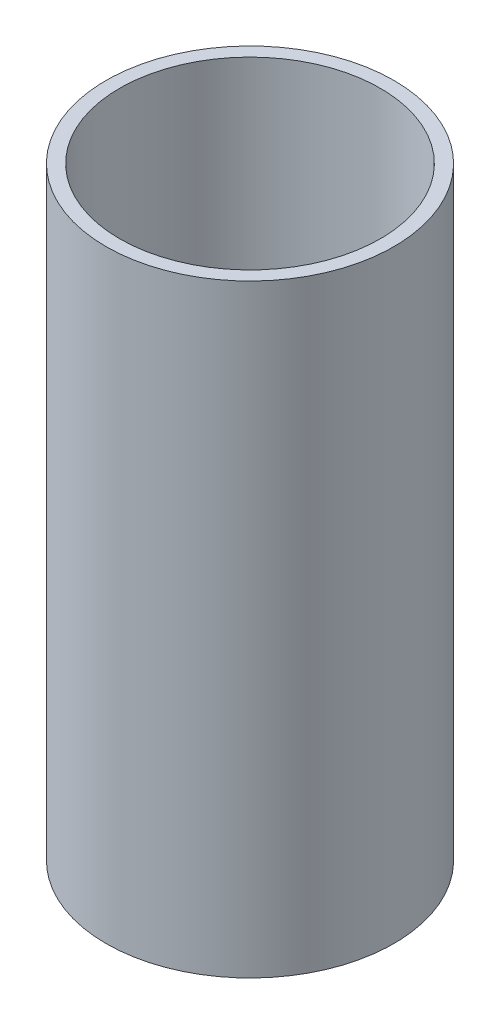
from build123d import *

# Parameters (mm, degrees)
SKETCH1_R           = 11.925
SKETCH1_R_2         = 9.525
BOSS_EXTRUDE1_DEPTH = 50
SKETCH2_R           = 10.85
CUT_EXTRUDE1_DEPTH  = 20
SKETCH3_R           = 10.8
CUT_EXTRUDE2_DEPTH  = 20


with BuildPart() as part:
    # Sketch1 → Boss-Extrude1 (new body)
    with BuildSketch(Plane(origin=(0, 0, 0), x_dir=(1, 0, 0), z_dir=(0, 1, 0))):
        with Locations(Location((0, 0, 0), (0, 0, 270))):
            Circle(SKETCH1_R)
        with Locations(Location((0, 0, 0), (0, 0, 270))):
            Circle(SKETCH1_R_2, mode=Mode.SUBTRACT)
    extrude(amount=BOSS_EXTRUDE1_DEPTH)

    # Sketch2 → Cut-Extrude1 (cut)
    with BuildSketch(Plane.XZ):
        with Locations(Location((0, 0, 0), (0, 0, 270))):
            Circle(SKETCH2_R)
    extrude(amount=-CUT_EXTRUDE1_DEPTH, mode=Mode.SUBTRACT)

    # Sketch3 → Cut-Extrude2 (cut)
    with BuildSketch(Plane(origin=(0, 50, 0), x_dir=(1, 0, 0), z_dir=(0, 1, 0))):
        with Locations(Location((0, 0, 0), (0, 0, 270))):
            Circle(SKETCH3_R)
    extrude(amount=-CUT_EXTRUDE2_DEPTH, mode=Mode.SUBTRACT)


solid = part.part
